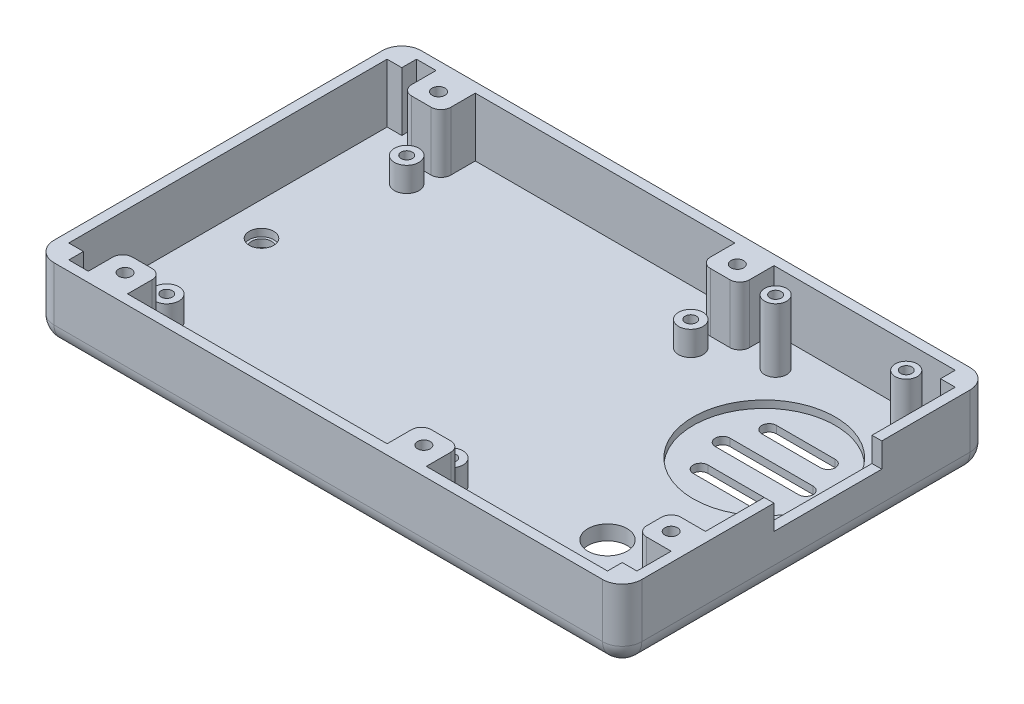
from build123d import *

# Parameters (mm, degrees)
SKETCH1_W                   = 120
SKETCH1_H                   = 75
MAIN_STRUCTURE_DEPTH        = 15
SKETCH2_W                   = 116
SKETCH2_H                   = 71
INSIDE_CUT_DEPTH            = 12
SKETCH3_R                   = 2.5
SKETCH3_R_2                 = 1.15
PI_STANDOFFS_DEPTH          = 5
SKETCH4_R                   = 2
SKETCH4_R_2                 = 0.9
CAMERA_STANDOFFS_DEPTH      = 5
BODY_FILLET_1_R             = 4
BODY_FILLET_2_R             = 4
BODY_FILLET_3_R             = 4
BODY_FILLET_4_R             = 4
SKETCH5_R                   = 2.25
SKETCH5_R_2                 = 1.15
FONA_STANDOFFS_DEPTH        = 13
SKETCH6_W                   = 3
SKETCH6_H                   = 3
CORNER_SUPPORT_DEPTH        = 12
SKETCH8_W                   = 22
SKETCH8_H                   = 5
CHARGER_CUTOUT_DEPTH        = 10
SKETCH9_W                   = 8
SKETCH9_H                   = 7
SKETCH9_W_2                 = 7
MOUNTING_STRUCTURE_DEPTH    = 12
MOUNTING_STRUCTURE_FILLET_R = 2
SKETCH10_R                  = 1.3
CASE_MOUNTING_HOLES_DEPTH   = 15
SKETCH13_R                  = 2.9
CASE_SCREW_HEAD_HOLES_DEPTH = 8.85
SKETCH14_R                  = 14.5
SPEAKER_HOLDER_DEPTH        = 1.5
SOUND_CUTOUT_DEPTH          = 1.5
SKETCH25_R                  = 2.5
MICROPHONE_HOLDER_DEPTH     = 1.5
SKETCH26_R                  = 2
MICROPHONE_CUTOUT_DEPTH     = 1.5
SKETCH27_R                  = 4
CAMERA_CUTOUT_DEPTH         = 10


with BuildPart() as part:
    # Sketch1 → Main Structure (new body)
    with BuildSketch(Plane(origin=(0, 0, 0), x_dir=(1, 0, 0), z_dir=(0, 1, 0))):
        Rectangle(SKETCH1_W, SKETCH1_H)
    extrude(amount=MAIN_STRUCTURE_DEPTH)

    # Sketch2 → Inside Cut (cut)
    with BuildSketch(Plane(origin=(0, 15, 0), x_dir=(1, 0, 0), z_dir=(0, 1, 0))):
        Rectangle(SKETCH2_W, SKETCH2_H)
    extrude(amount=-INSIDE_CUT_DEPTH, mode=Mode.SUBTRACT)

    # Sketch3 → Pi Standoffs (add)
    # profile 1 of 4: a face of its own
    with BuildSketch(Plane(origin=(0, 3, 0), x_dir=(1, 0, 0), z_dir=(0, 1, 0))):
        with Locations(Location((-46, -24.5, 0), (0, 0, 90))):
            Circle(SKETCH3_R)
        with Locations(Location((-46, -24.5, 0), (0, 0, 270))):
            Circle(SKETCH3_R_2, mode=Mode.SUBTRACT)
    # profile 2 of 4: a face of its own
    with BuildSketch(Plane(origin=(0, 3, 0), x_dir=(1, 0, 0), z_dir=(0, 1, 0))):
        with Locations(Location((-46, 24.5, 0), (0, 0, 90))):
            Circle(SKETCH3_R)
        with Locations(Location((-46, 24.5, 0), (0, 0, 270))):
            Circle(SKETCH3_R_2, mode=Mode.SUBTRACT)
    # profile 3 of 4: a face of its own
    with BuildSketch(Plane(origin=(0, 3, 0), x_dir=(1, 0, 0), z_dir=(0, 1, 0))):
        with Locations(Location((12, 24.5, 0), (0, 0, 90))):
            Circle(SKETCH3_R)
        with Locations(Location((12, 24.5, 0), (0, 0, 270))):
            Circle(SKETCH3_R_2, mode=Mode.SUBTRACT)
    # profile 4 of 4: a face of its own
    with BuildSketch(Plane(origin=(0, 3, 0), x_dir=(1, 0, 0), z_dir=(0, 1, 0))):
        with Locations(Location((12, -24.5, 0), (0, 0, 90))):
            Circle(SKETCH3_R)
        with Locations(Location((12, -24.5, 0), (0, 0, 270))):
            Circle(SKETCH3_R_2, mode=Mode.SUBTRACT)
    extrude(amount=PI_STANDOFFS_DEPTH)

    # Sketch4 → Camera Standoffs (add)
    # profile 1 of 2: a face of its own
    with BuildSketch(Plane(origin=(0, 3, 0), x_dir=(1, 0, 0), z_dir=(0, 1, 0))):
        with Locations(Location((48, -30.5, 0), (0, 0, 90))):
            Circle(SKETCH4_R)
        with Locations(Location((48, -30.5, 0), (0, 0, 270))):
            Circle(SKETCH4_R_2, mode=Mode.SUBTRACT)
    # profile 2 of 2: a face of its own
    with BuildSketch(Plane(origin=(0, 3, 0), x_dir=(1, 0, 0), z_dir=(0, 1, 0))):
        with Locations(Location((48, -17.5, 0), (0, 0, 90))):
            Circle(SKETCH4_R)
        with Locations(Location((48, -17.5, 0), (0, 0, 270))):
            Circle(SKETCH4_R_2, mode=Mode.SUBTRACT)
    extrude(amount=CAMERA_STANDOFFS_DEPTH)

    # Body Fillet 1
    body_fillet_1_edges = [part.edges().sort_by_distance(p)[0] for p in [
        (-60, 0, 0),
    ]]
    fillet(body_fillet_1_edges, radius=BODY_FILLET_1_R)

    # Body Fillet 2
    body_fillet_2_edges = [part.edges().sort_by_distance(p)[0] for p in [
        (2, 0, -37.5),
        (-58.828427125, 1.171572875, -37.5),
        (-60, 9.5, -37.5),
    ]]
    fillet(body_fillet_2_edges, radius=BODY_FILLET_2_R)

    # Body Fillet 3
    body_fillet_3_edges = [part.edges().sort_by_distance(p)[0] for p in [
        (2, 0, 37.5),
        (-58.828427125, 1.171572875, 37.5),
        (-60, 9.5, 37.5),
    ]]
    fillet(body_fillet_3_edges, radius=BODY_FILLET_3_R)

    # Body Fillet 4
    body_fillet_4_edges = [part.edges().sort_by_distance(p)[0] for p in [
        (60, 9.5, 37.5),
        (60, 9.5, -37.5),
        (60, 1.171572875, -36.328427125),
        (60, 0, 0),
        (60, 1.171572875, 36.328427125),
    ]]
    fillet(body_fillet_4_edges, radius=BODY_FILLET_4_R)

    # Sketch5 → Fona Standoffs (add)
    # profile 1 of 2: a face of its own
    with BuildSketch(Plane(origin=(0, 3, 0), x_dir=(1, 0, 0), z_dir=(0, 1, 0))):
        with Locations(Location((24.33, 29.5, 0), (0, 0, 90))):
            Circle(SKETCH5_R)
        with Locations(Location((24.33, 29.5, 0), (0, 0, 90))):
            Circle(SKETCH5_R_2, mode=Mode.SUBTRACT)
    # profile 2 of 2: a face of its own
    with BuildSketch(Plane(origin=(0, 3, 0), x_dir=(1, 0, 0), z_dir=(0, 1, 0))):
        with Locations(Location((51, 29.5, 0), (0, 0, 90))):
            Circle(SKETCH5_R)
        with Locations(Location((51, 29.5, 0), (0, 0, 90))):
            Circle(SKETCH5_R_2, mode=Mode.SUBTRACT)
    extrude(amount=FONA_STANDOFFS_DEPTH)

    # Sketch6 → Corner Support (add)
    with BuildSketch(Plane(origin=(0, 3, 0), x_dir=(1, 0, 0), z_dir=(0, 1, 0))):
        with Locations((-56.5, -34)):
            Rectangle(SKETCH6_W, SKETCH6_H)
        with Locations((-56.5, 34)):
            Rectangle(SKETCH6_W, SKETCH6_H)
        with Locations((56.5, -34)):
            Rectangle(SKETCH6_W, SKETCH6_H)
        with Locations((56.5, 34)):
            Rectangle(SKETCH6_W, SKETCH6_H)
    extrude(amount=CORNER_SUPPORT_DEPTH)

    # Sketch8 → Charger Cutout (cut)
    with BuildSketch(Plane(origin=(60, 0, 0), x_dir=(0, 0, -1), z_dir=(1, 0, 0))):
        with Locations((4.5, 12.5)):
            Rectangle(SKETCH8_W, SKETCH8_H)
    extrude(amount=-CHARGER_CUTOUT_DEPTH, mode=Mode.SUBTRACT)

    # Sketch9 → Mounting Structure (add)
    with BuildSketch(Plane(origin=(0, 3, 0), x_dir=(1, 0, 0), z_dir=(0, 1, 0))):
        with Locations((-47, -32)):
            Rectangle(SKETCH9_W, SKETCH9_H)
        with Locations((54.5, -22)):
            Rectangle(SKETCH9_W_2, SKETCH9_H)
        with Locations((-47, 32)):
            Rectangle(SKETCH9_W, SKETCH9_H)
        with Locations((14, 32)):
            Rectangle(SKETCH9_W, SKETCH9_H)
        with Locations((14, -32)):
            Rectangle(SKETCH9_W, SKETCH9_H)
    extrude(amount=MOUNTING_STRUCTURE_DEPTH)

    # Mounting Structure Fillet
    mounting_structure_fillet_edges = [part.edges().sort_by_distance(p)[0] for p in [
        (-43, 9, 28.5),
        (-51, 9, 28.5),
        (51, 9, 18.5),
        (51, 9, 25.5),
        (-43, 9, -28.5),
        (-51, 9, -28.5),
        (18, 9, -28.5),
        (10, 9, -28.5),
        (18, 9, 28.5),
        (10, 9, 28.5),
    ]]
    fillet(mounting_structure_fillet_edges, radius=MOUNTING_STRUCTURE_FILLET_R)

    # Sketch10 → Case Mounting Holes (cut)
    with BuildSketch(Plane(origin=(0, 15, 0), x_dir=(1, 0, 0), z_dir=(0, 1, 0))):
        with Locations(Location((-47, 32, 0), (0, 0, 270))):
            Circle(SKETCH10_R)
        with Locations(Location((-47, -32, 0), (0, 0, 270))):
            Circle(SKETCH10_R)
        with Locations(Location((14, -32, 0), (0, 0, 270))):
            Circle(SKETCH10_R)
        with Locations(Location((14, 32, 0), (0, 0, 270))):
            Circle(SKETCH10_R)
        with Locations(Location((54.5, -22, 0), (0, 0, 270))):
            Circle(SKETCH10_R)
    extrude(amount=-CASE_MOUNTING_HOLES_DEPTH, mode=Mode.SUBTRACT)

    # Sketch13 → Case Screw Head Holes (cut)
    with BuildSketch(Plane.XZ):
        with Locations(Location((-47, 32, 0), (0, 0, 270))):
            Circle(SKETCH13_R)
        with Locations(Location((14, 32, 0), (0, 0, 270))):
            Circle(SKETCH13_R)
        with Locations(Location((14, -32, 0), (0, 0, 270))):
            Circle(SKETCH13_R)
        with Locations(Location((-47, -32, 0), (0, 0, 270))):
            Circle(SKETCH13_R)
        with Locations(Location((54.5, 22, 0), (0, 0, 270))):
            Circle(SKETCH13_R)
    extrude(amount=-CASE_SCREW_HEAD_HOLES_DEPTH, mode=Mode.SUBTRACT)

    # Sketch14 → Speaker Holder (cut)
    with BuildSketch(Plane(origin=(0, 3, 0), x_dir=(1, 0, 0), z_dir=(0, 1, 0))):
        with Locations(Location((39, 12.5, 0), (0, 0, 270))):
            Circle(SKETCH14_R)
    extrude(amount=-SPEAKER_HOLDER_DEPTH, mode=Mode.SUBTRACT)

    # Sketch23 → Sound Cutout (cut)
    with BuildSketch(Plane(origin=(0, 1.5, 0), x_dir=(1, 0, 0), z_dir=(0, 1, 0))):
        with BuildLine():
            Line((33, 21), (45, 21))
            ThreePointArc((45, 21), (46.5, 19.5), (45, 18))
            Line((45, 18), (33, 18))
            ThreePointArc((33, 18), (31.5, 19.5), (33, 21))
        make_face()
        with BuildLine():
            Line((30.5, 14), (47.5, 14))
            ThreePointArc((47.5, 14), (49, 12.5), (47.5, 11))
            Line((47.5, 11), (30.5, 11))
            ThreePointArc((30.5, 11), (29, 12.5), (30.5, 14))
        make_face()
        with BuildLine():
            Line((33, 7), (45, 7))
            ThreePointArc((45, 7), (46.5, 5.5), (45, 4))
            Line((45, 4), (33, 4))
            ThreePointArc((33, 4), (31.5, 5.5), (33, 7))
        make_face()
    extrude(amount=-SOUND_CUTOUT_DEPTH, mode=Mode.SUBTRACT)

    # Sketch25 → Microphone holder (cut)
    with BuildSketch(Plane(origin=(0, 3, 0), x_dir=(1, 0, 0), z_dir=(0, 1, 0))):
        with Locations(Location((-51.147743093, 0, 0), (0, 0, 270))):
            Circle(SKETCH25_R)
    extrude(amount=-MICROPHONE_HOLDER_DEPTH, mode=Mode.SUBTRACT)

    # Sketch26 → Microphone Cutout (cut)
    with BuildSketch(Plane(origin=(0, 1.5, 0), x_dir=(1, 0, 0), z_dir=(0, 1, 0))):
        with Locations(Location((-51.147743093, 0, 0), (0, 0, 270))):
            Circle(SKETCH26_R)
    extrude(amount=-MICROPHONE_CUTOUT_DEPTH, mode=Mode.SUBTRACT)

    # Sketch27 → Camera Cutout (cut)
    with BuildSketch(Plane(origin=(0, 3, 0), x_dir=(1, 0, 0), z_dir=(0, 1, 0))):
        with Locations(Location((37.5, -18, 0), (0, 0, 270))):
            Circle(SKETCH27_R)
    extrude(amount=-CAMERA_CUTOUT_DEPTH, mode=Mode.SUBTRACT)


solid = part.part
